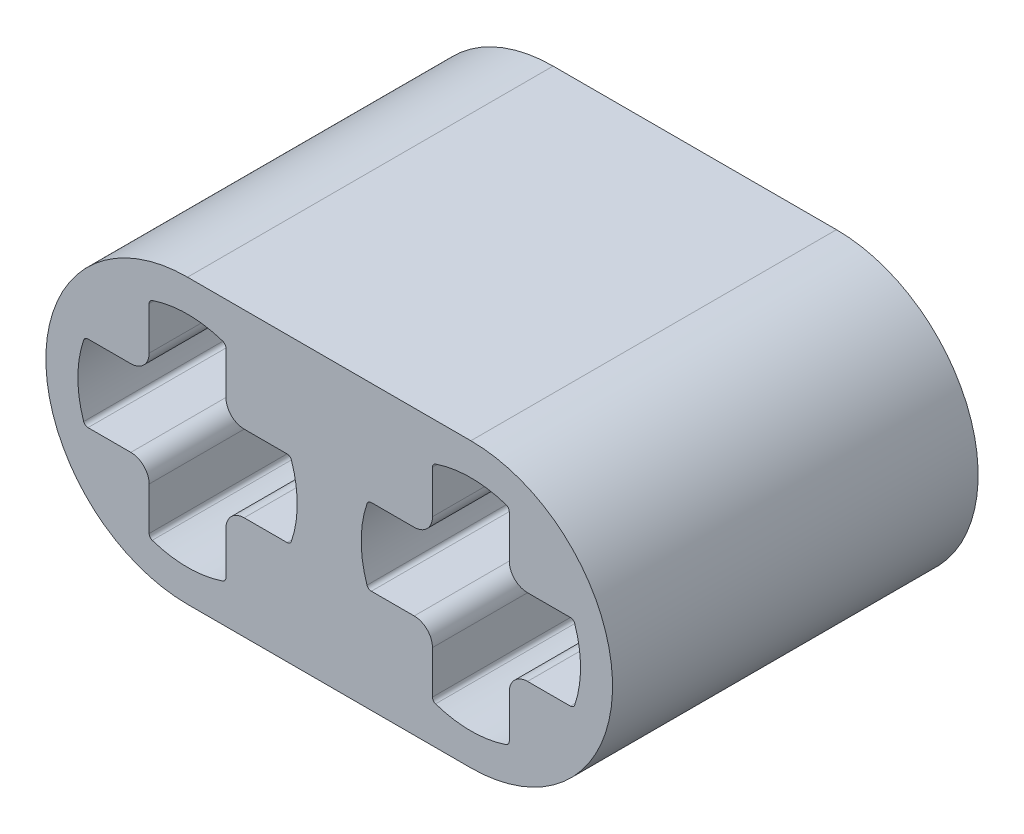
from build123d import *

# Parameters (mm, degrees)
BOSS_EXTRUDE1_DEPTH   = 8
CUT_EXTRUDE1_DEPTH    = 11.585367259
FILLET1_R             = 0.4
FILLET2_R             = 0.4
FILLET3_R             = 0.4
FILLET4_R             = 0.4
FILLET5_R             = 0.1
FILLET6_R             = 0.1
FILLET7_R             = 0.1
FILLET8_R             = 0.1
FILLET9_R             = 0.1
FILLET10_R            = 0.1
FILLET11_R            = 0.1
FILLET12_R            = 0.1
FILLET1_OF_MIRROR1_R  = 0.4
FILLET2_OF_MIRROR1_R  = 0.4
FILLET3_OF_MIRROR1_R  = 0.4
FILLET4_OF_MIRROR1_R  = 0.4
FILLET5_OF_MIRROR1_R  = 0.1
FILLET6_OF_MIRROR1_R  = 0.1
FILLET7_OF_MIRROR1_R  = 0.1
FILLET8_OF_MIRROR1_R  = 0.1
FILLET9_OF_MIRROR1_R  = 0.1
FILLET10_OF_MIRROR1_R = 0.1
FILLET11_OF_MIRROR1_R = 0.1
FILLET12_OF_MIRROR1_R = 0.1


with BuildPart() as part:
    # Sketch2 → Boss-Extrude1 (new body)
    with BuildSketch(Plane.XY):
        with BuildLine():
            Line((-3.1, 3.1), (3.1, 3.1))
            ThreePointArc((3.1, 3.1), (6.2, 0), (3.1, -3.1))
            Line((3.1, -3.1), (-3.1, -3.1))
            ThreePointArc((-3.1, -3.1), (-6.2, 0), (-3.1, 3.1))
        make_face()
    extrude(amount=-BOSS_EXTRUDE1_DEPTH)

    # Sketch4 → Cut-Extrude1 (cut, through all)
    with BuildSketch(Plane.XY):
        with BuildLine():
            Line((-3.94, -0.84), (-3.94, -2.248199279))
            ThreePointArc((-3.94, -2.248199279), (-3.1, -2.4), (-2.26, -2.248199279))
            Line((-2.26, -2.248199279), (-2.26, -0.84))
            Line((-2.26, -0.84), (-0.851800721, -0.84))
            ThreePointArc((-0.851800721, -0.84), (-0.7, 0), (-0.851800721, 0.84))
            Line((-0.851800721, 0.84), (-2.26, 0.84))
            Line((-2.26, 0.84), (-2.26, 2.248199279))
            ThreePointArc((-2.26, 2.248199279), (-3.1, 2.4), (-3.94, 2.248199279))
            Line((-3.94, 2.248199279), (-3.94, 0.84))
            Line((-3.94, 0.84), (-5.348199279, 0.84))
            ThreePointArc((-5.348199279, 0.84), (-5.5, 0), (-5.348199279, -0.84))
            Line((-5.348199279, -0.84), (-3.94, -0.84))
        make_face()
    cut_extrude1 = extrude(amount=-CUT_EXTRUDE1_DEPTH, mode=Mode.SUBTRACT)

    # Fillet1
    fillet1_edges = [part.edges().sort_by_distance(p)[0] for p in [
        (-3.94, -0.84, -4),
    ]]
    fillet(fillet1_edges, radius=FILLET1_R)

    # Fillet2
    fillet2_edges = [part.edges().sort_by_distance(p)[0] for p in [
        (-3.94, 0.84, -4),
    ]]
    fillet(fillet2_edges, radius=FILLET2_R)

    # Fillet3
    fillet3_edges = [part.edges().sort_by_distance(p)[0] for p in [
        (-2.26, 0.84, -4),
    ]]
    fillet(fillet3_edges, radius=FILLET3_R)

    # Fillet4
    fillet4_edges = [part.edges().sort_by_distance(p)[0] for p in [
        (-2.26, -0.84, -4),
    ]]
    fillet(fillet4_edges, radius=FILLET4_R)

    # Fillet5
    fillet5_edges = [part.edges().sort_by_distance(p)[0] for p in [
        (-3.94, -2.248199279, -4),
    ]]
    fillet(fillet5_edges, radius=FILLET5_R)

    # Fillet6
    fillet6_edges = [part.edges().sort_by_distance(p)[0] for p in [
        (-2.26, -2.248199279, -4),
    ]]
    fillet(fillet6_edges, radius=FILLET6_R)

    # Fillet7
    fillet7_edges = [part.edges().sort_by_distance(p)[0] for p in [
        (-0.851800721, 0.84, -4),
    ]]
    fillet(fillet7_edges, radius=FILLET7_R)

    # Fillet8
    fillet8_edges = [part.edges().sort_by_distance(p)[0] for p in [
        (-0.851800721, -0.84, -4),
    ]]
    fillet(fillet8_edges, radius=FILLET8_R)

    # Fillet9
    fillet9_edges = [part.edges().sort_by_distance(p)[0] for p in [
        (-2.26, 2.248199279, -4),
    ]]
    fillet(fillet9_edges, radius=FILLET9_R)

    # Fillet10
    fillet10_edges = [part.edges().sort_by_distance(p)[0] for p in [
        (-3.94, 2.248199279, -4),
    ]]
    fillet(fillet10_edges, radius=FILLET10_R)

    # Fillet11
    fillet11_edges = [part.edges().sort_by_distance(p)[0] for p in [
        (-5.348199279, 0.84, -4),
    ]]
    fillet(fillet11_edges, radius=FILLET11_R)

    # Fillet12
    fillet12_edges = [part.edges().sort_by_distance(p)[0] for p in [
        (-5.348199279, -0.84, -4),
    ]]
    fillet(fillet12_edges, radius=FILLET12_R)

    # Mirror1: Cut-Extrude1 across plane
    add(cut_extrude1.mirror(Plane(origin=(0, 0, 0), x_dir=(0, 0, 1), z_dir=(1, 0, 0))), mode=Mode.SUBTRACT)

    # Fillet1 of Mirror1
    fillet1_of_mirror1_edges = [part.edges().sort_by_distance(p)[0] for p in [
        (3.94, -0.84, -4),
    ]]
    fillet(fillet1_of_mirror1_edges, radius=FILLET1_OF_MIRROR1_R)

    # Fillet2 of Mirror1
    fillet2_of_mirror1_edges = [part.edges().sort_by_distance(p)[0] for p in [
        (3.94, 0.84, -4),
    ]]
    fillet(fillet2_of_mirror1_edges, radius=FILLET2_OF_MIRROR1_R)

    # Fillet3 of Mirror1
    fillet3_of_mirror1_edges = [part.edges().sort_by_distance(p)[0] for p in [
        (2.26, 0.84, -4),
    ]]
    fillet(fillet3_of_mirror1_edges, radius=FILLET3_OF_MIRROR1_R)

    # Fillet4 of Mirror1
    fillet4_of_mirror1_edges = [part.edges().sort_by_distance(p)[0] for p in [
        (2.26, -0.84, -4),
    ]]
    fillet(fillet4_of_mirror1_edges, radius=FILLET4_OF_MIRROR1_R)

    # Fillet5 of Mirror1
    fillet5_of_mirror1_edges = [part.edges().sort_by_distance(p)[0] for p in [
        (3.94, -2.248199279, -4),
    ]]
    fillet(fillet5_of_mirror1_edges, radius=FILLET5_OF_MIRROR1_R)

    # Fillet6 of Mirror1
    fillet6_of_mirror1_edges = [part.edges().sort_by_distance(p)[0] for p in [
        (2.26, -2.248199279, -4),
    ]]
    fillet(fillet6_of_mirror1_edges, radius=FILLET6_OF_MIRROR1_R)

    # Fillet7 of Mirror1
    fillet7_of_mirror1_edges = [part.edges().sort_by_distance(p)[0] for p in [
        (0.851800721, 0.84, -4),
    ]]
    fillet(fillet7_of_mirror1_edges, radius=FILLET7_OF_MIRROR1_R)

    # Fillet8 of Mirror1
    fillet8_of_mirror1_edges = [part.edges().sort_by_distance(p)[0] for p in [
        (0.851800721, -0.84, -4),
    ]]
    fillet(fillet8_of_mirror1_edges, radius=FILLET8_OF_MIRROR1_R)

    # Fillet9 of Mirror1
    fillet9_of_mirror1_edges = [part.edges().sort_by_distance(p)[0] for p in [
        (2.26, 2.248199279, -4),
    ]]
    fillet(fillet9_of_mirror1_edges, radius=FILLET9_OF_MIRROR1_R)

    # Fillet10 of Mirror1
    fillet10_of_mirror1_edges = [part.edges().sort_by_distance(p)[0] for p in [
        (3.94, 2.248199279, -4),
    ]]
    fillet(fillet10_of_mirror1_edges, radius=FILLET10_OF_MIRROR1_R)

    # Fillet11 of Mirror1
    fillet11_of_mirror1_edges = [part.edges().sort_by_distance(p)[0] for p in [
        (5.348199279, 0.84, -4),
    ]]
    fillet(fillet11_of_mirror1_edges, radius=FILLET11_OF_MIRROR1_R)

    # Fillet12 of Mirror1
    fillet12_of_mirror1_edges = [part.edges().sort_by_distance(p)[0] for p in [
        (5.348199279, -0.84, -4),
    ]]
    fillet(fillet12_of_mirror1_edges, radius=FILLET12_OF_MIRROR1_R)


solid = part.part
